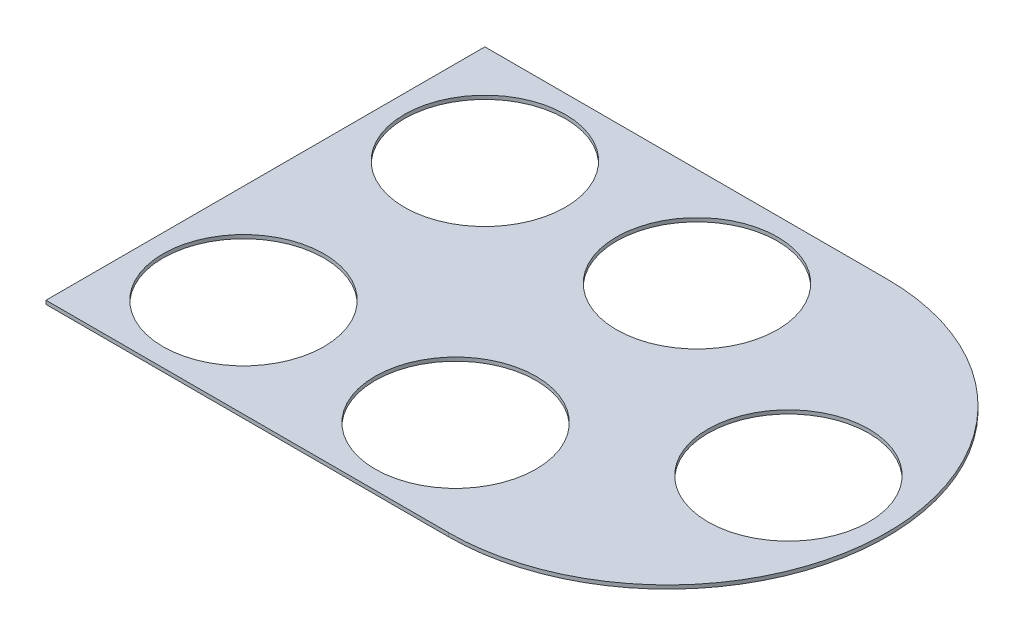
from build123d import *

# Parameters (mm, degrees)
SKETCH1_R           = 55.88
BOSS_EXTRUDE1_DEPTH = 2.54


with BuildPart() as part:
    # Sketch1 → Boss-Extrude1 (new body)
    with BuildSketch(Plane(origin=(0, 0, 0), x_dir=(1, 0, 0), z_dir=(0, 1, 0))):
        with BuildLine():
            Line((0, 0), (279.4, 0))
            ThreePointArc((279.4, 0), (431.8, 152.4), (279.4, 304.8))
            Line((279.4, 304.8), (0, 304.8))
            Line((0, 304.8), (0, 0))
        make_face()
        with Locations(Location((68.58, 236.22, 0), (0, 0, 270))):
            Circle(SKETCH1_R, mode=Mode.SUBTRACT)
        with Locations(Location((215.9, 236.22, 0), (0, 0, 270))):
            Circle(SKETCH1_R, mode=Mode.SUBTRACT)
        with Locations(Location((363.22, 152.4, 0), (0, 0, 270))):
            Circle(SKETCH1_R, mode=Mode.SUBTRACT)
        with Locations(Location((68.58, 68.58, 0), (0, 0, 90))):
            Circle(SKETCH1_R, mode=Mode.SUBTRACT)
        with Locations(Location((215.9, 68.58, 0), (0, 0, 90))):
            Circle(SKETCH1_R, mode=Mode.SUBTRACT)
    extrude(amount=BOSS_EXTRUDE1_DEPTH)


solid = part.part
